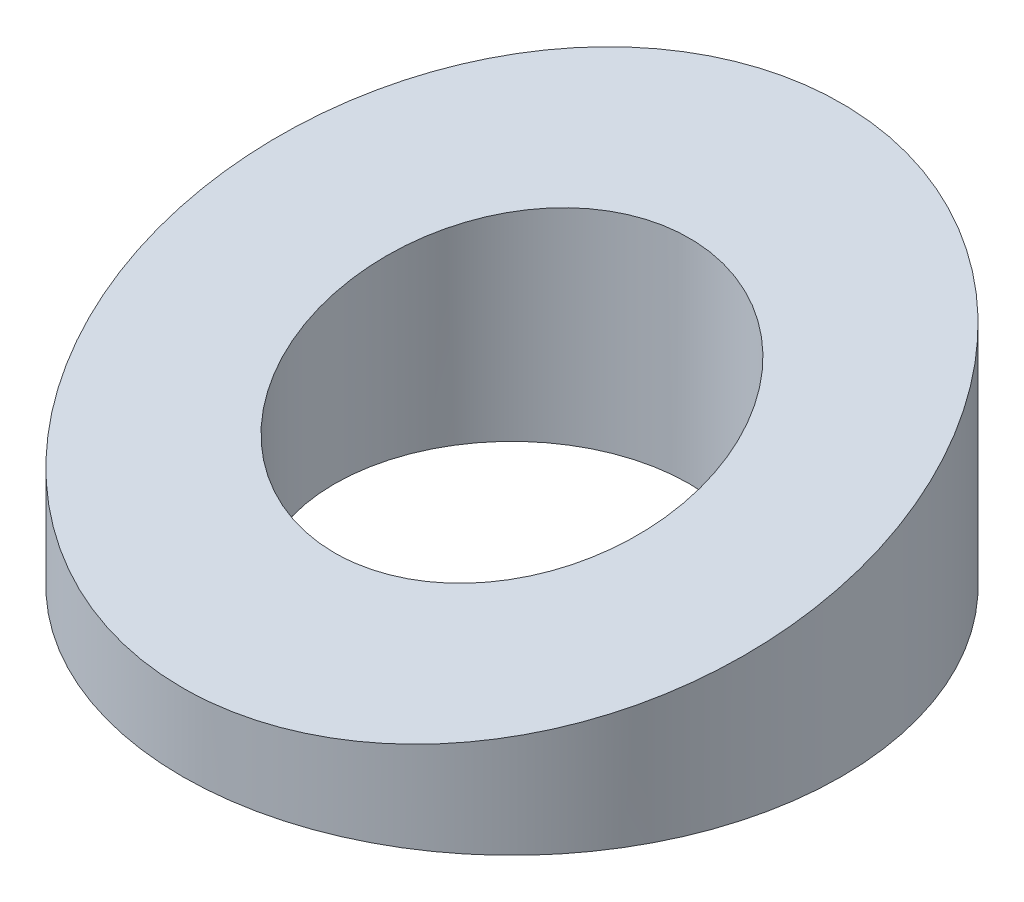
from build123d import *

# Parameters (mm, degrees)
SKETCH1_R               = 6.5
SKETCH1_R_2             = 3.5
BOSS_EXTRUDE1_DEPTH     = 5
CUT_EXTRUDE1_DEPTH      = 10
CUT_EXTRUDE1_DEPTH_BACK = 10


with BuildPart() as part:
    # Sketch1 → Boss-Extrude1 (new body)
    with BuildSketch(Plane(origin=(0, 0, 0), x_dir=(1, 0, 0), z_dir=(0, 1, 0))):
        with Locations(Location((0, 0, 0), (0, 0, 270))):
            Circle(SKETCH1_R)
        with Locations(Location((0, 0, 0), (0, 0, 270))):
            Circle(SKETCH1_R_2, mode=Mode.SUBTRACT)
    extrude(amount=BOSS_EXTRUDE1_DEPTH)

    # Sketch2 → Cut-Extrude1 (cut, two sides: drawn at the far end of the back side and taken through both)
    with BuildSketch(Plane(origin=(0, 0, 0), x_dir=(0, 0, -1), z_dir=(1, 0, 0)).offset(-CUT_EXTRUDE1_DEPTH_BACK)):
        Polygon((-6.5, 5), (6.5, 5), (-6.5, 1.516660498), align=None)
    extrude(amount=CUT_EXTRUDE1_DEPTH + CUT_EXTRUDE1_DEPTH_BACK, mode=Mode.SUBTRACT)


solid = part.part
